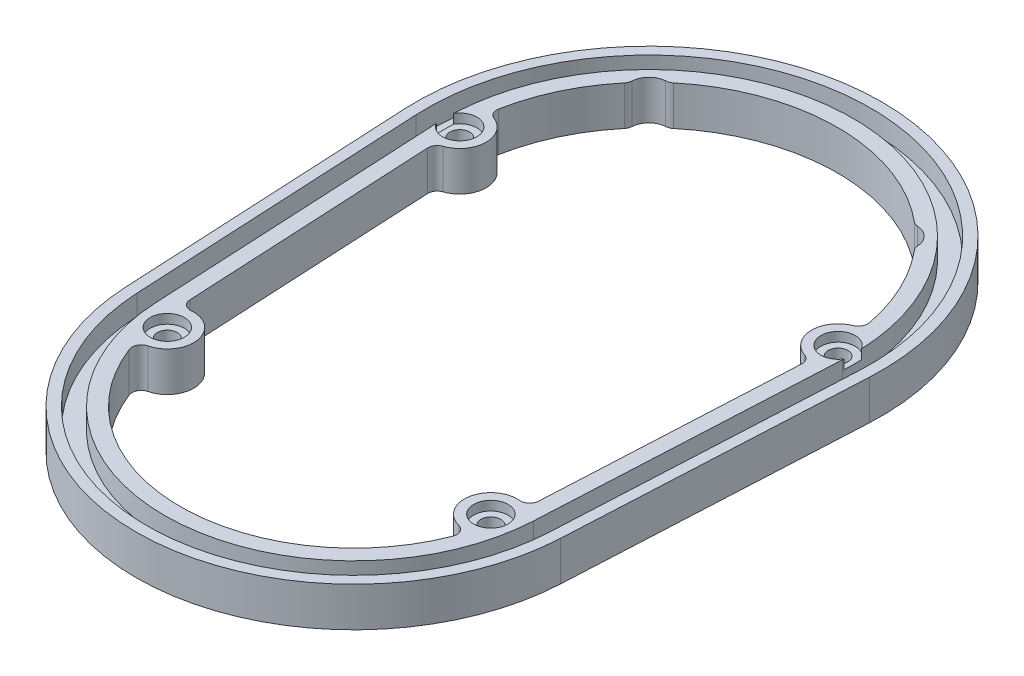
from build123d import *

# Parameters (mm, degrees)
SKETCH1_R           = 40
SKETCH1_R_2         = 50.8
SKETCH1_R_3         = 5.75
BOSS_EXTRUDE1_DEPTH = 12.7
SKETCH10_R          = 3.175
CUT_EXTRUDE6_DEPTH  = 194.127134292
SKETCH12_R          = 5.5
CUT_EXTRUDE8_DEPTH  = 3
CUT_EXTRUDE9_DEPTH  = 6.5
CUT_EXTRUDE10_DEPTH = 194.127134292
FILLET1_R           = 3
FILLET2_R           = 3


with BuildPart() as part:
    # Sketch1 → Boss-Extrude1 (new body)
    with BuildSketch(Plane(origin=(0, 0, 0), x_dir=(1, 0, 0), z_dir=(0, 1, 0))):
        with BuildLine():
            Line((-74.704056398, 99.012658228), (-69.910213207, 4.455696203))
            ThreePointArc((-69.910213207, 4.455696203), (0, -62), (69.910213207, 4.455696203))
            Line((69.910213207, 4.455696203), (74.704056398, 99.012658228))
            ThreePointArc((74.704056398, 99.012658228), (0, 177.6), (-74.704056398, 99.012658228))
        make_face()
        with Locations(Location((0, 0, 0), (0, 0, 270))):
            Circle(SKETCH1_R, mode=Mode.SUBTRACT)
        with Locations(Location((0, 102.8, 0), (0, 0, 270))):
            Circle(SKETCH1_R_2, mode=Mode.SUBTRACT)
        with Locations(Location((40.163665171, 142.963665171, 0), (0, 0, 270))):
            Circle(SKETCH1_R_3, mode=Mode.SUBTRACT)
        with Locations(Location((40.163665171, 62.636334829, 0), (0, 0, 270))):
            Circle(SKETCH1_R_3, mode=Mode.SUBTRACT)
        with Locations(Location((-40.163665171, 62.636334829, 0), (0, 0, 270))):
            Circle(SKETCH1_R_3, mode=Mode.SUBTRACT)
        with Locations(Location((-40.163665171, 142.963665171, 0), (0, 0, 270))):
            Circle(SKETCH1_R_3, mode=Mode.SUBTRACT)
    extrude(amount=BOSS_EXTRUDE1_DEPTH)

    # Sketch10 → Cut-Extrude6 (cut, through all)
    with BuildSketch(Plane(origin=(0, 12.7, 0), x_dir=(1, 0, 0), z_dir=(0, 1, 0))):
        with Locations(Location((-52, 0, 0), (0, 0, 270))):
            Circle(SKETCH10_R)
        with Locations(Location((-60.8, 102.8, 0), (0, 0, 270))):
            Circle(SKETCH10_R)
        with Locations(Location((60.8, 102.8, 0), (0, 0, 90))):
            Circle(SKETCH10_R)
        with Locations(Location((52, 0, 0), (0, 0, 90))):
            Circle(SKETCH10_R)
    extrude(amount=-CUT_EXTRUDE6_DEPTH, mode=Mode.SUBTRACT)

    # Sketch12 → Cut-Extrude8 (cut)
    with BuildSketch(Plane(origin=(0, 12.7, 0), x_dir=(1, 0, 0), z_dir=(0, 1, 0))):
        with Locations(Location((-60.8, 102.8, 0), (0, 0, 270))):
            Circle(SKETCH12_R)
        with Locations(Location((60.8, 102.8, 0), (0, 0, 270))):
            Circle(SKETCH12_R)
        with Locations(Location((52, 0, 0), (0, 0, 270))):
            Circle(SKETCH12_R)
        with Locations(Location((-52, 0, 0), (0, 0, 270))):
            Circle(SKETCH12_R)
    extrude(amount=-CUT_EXTRUDE8_DEPTH, mode=Mode.SUBTRACT)

    # Sketch13 → Cut-Extrude9 (cut)
    with BuildSketch(Plane(origin=(0, 12.7, 0), x_dir=(1, 0, 0), z_dir=(0, 1, 0))):
        with BuildLine():
            Line((-71.208545738, 99.189873418), (-66.414702546, 4.632911392))
            ThreePointArc((-66.414702546, 4.632911392), (0, -58.5), (66.414702546, 4.632911392))
            Line((66.414702546, 4.632911392), (71.208545738, 99.189873418))
            ThreePointArc((71.208545738, 99.189873418), (0, 174.1), (-71.208545738, 99.189873418))
        make_face()
        with BuildLine():
            Line((-65.515856948, 99.478481013), (-60.722013757, 4.921518987))
            ThreePointArc((-60.722013757, 4.921518987), (0, -52.8), (60.722013757, 4.921518987))
            Line((60.722013757, 4.921518987), (65.515856948, 99.478481013))
            ThreePointArc((65.515856948, 99.478481013), (0, 168.4), (-65.515856948, 99.478481013))
        make_face(mode=Mode.SUBTRACT)
    extrude(amount=-CUT_EXTRUDE9_DEPTH, mode=Mode.SUBTRACT)

    # Sketch14 → Cut-Extrude10 (cut, through all)
    with BuildSketch(Plane(origin=(0, 12.7, 0), x_dir=(1, 0, 0), z_dir=(0, 1, 0))):
        with BuildLine():
            Line((-60.247807343, 94.317955242), (-55.850268123, 7.577957204))
            ThreePointArc((-55.850268123, 7.577957204), (-43.603288319, 1.321072649), (-53.33734455, -8.394135426))
            ThreePointArc((-53.33734455, -8.394135426), (-33.157557534, -36.880022041), (0, -47.8))
            ThreePointArc((0, -47.8), (33.157557534, -36.880022041), (53.33734455, -8.394135426))
            ThreePointArc((53.33734455, -8.394135426), (43.603288319, 1.321072649), (55.850268123, 7.577957204))
            Line((55.850268123, 7.577957204), (60.247807343, 94.317955242))
            ThreePointArc((60.247807343, 94.317955242), (52.300864134, 102.678799624), (60.006167763, 111.262850015))
            ThreePointArc((60.006167763, 111.262850015), (39.746139995, 148.544992682), (0, 163.4))
            ThreePointArc((0, 163.4), (-39.746139995, 148.544992682), (-60.006167763, 111.262850015))
            ThreePointArc((-60.006167763, 111.262850015), (-52.300864134, 102.678799624), (-60.247807343, 94.317955242))
        make_face()
    extrude(amount=-CUT_EXTRUDE10_DEPTH, mode=Mode.SUBTRACT)

    # Fillet1
    fillet1_edges = [part.edges().sort_by_distance(p)[0] for p in [
        (-60.006167763, 6.35, -111.262850015),
        (-53.33734455, 6.35, 8.394135426),
        (-55.850268123, 6.35, -7.577957204),
        (-60.247807343, 6.35, -94.317955242),
        (60.006167763, 6.35, -111.262850015),
        (60.247807343, 6.35, -94.317955242),
        (55.850268123, 6.35, -7.577957204),
        (53.33734455, 6.35, 8.394135426),
    ]]
    fillet(fillet1_edges, radius=FILLET1_R)

    # Fillet2
    fillet2_edges = [part.edges().sort_by_distance(p)[0] for p in [
        (-39.585032528, 6.35, -148.684476675),
        (-45.884476675, 6.35, -142.385032528),
        (39.585032528, 6.35, -148.684476675),
        (45.884476675, 6.35, -142.385032528),
    ]]
    fillet(fillet2_edges, radius=FILLET2_R)


solid = part.part
